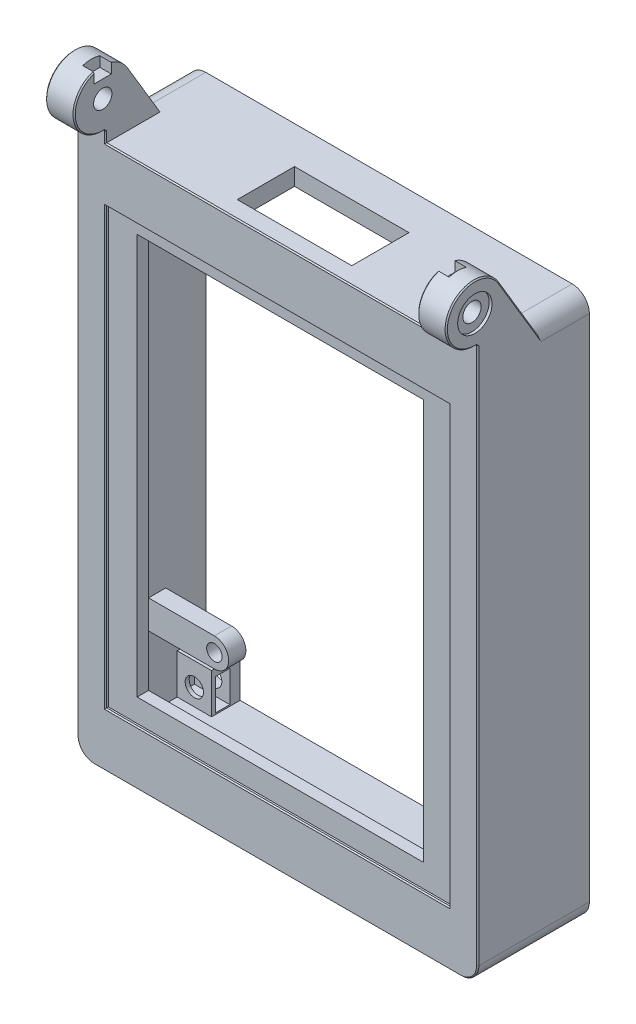
from build123d import *

# Parameters (mm, degrees)
SKETCH_1_W               = 70
SKETCH_1_H               = 95
EXTRUDE_1_DEPTH          = 20
SHELL_1_T                = -3
SKETCH_2_W               = 60
SKETCH_2_H               = 76
CUT_EXTRUDE_1_DEPTH      = 1
SKETCH_3_W               = 50
SKETCH_3_H               = 70
CUT_EXTRUDE_2_DEPTH      = 20
SKETCH_4_R               = 1.35
EXTRUDE_2_DEPTH          = 3
SKETCH_5_W               = 5
SKETCH_5_H               = 7
EXTRUDE_3_DEPTH          = 6
SKETCH_6_W               = 2.5
SKETCH_6_H               = 5.5
CUT_EXTRUDE_3_DEPTH      = 6.2
SKETCH_7_R               = 1.6
CUT_EXTRUDE_4_DEPTH      = 6.2
MIRROR_2_COPY_1_SKETCH_W = 5
MIRROR_2_COPY_1_SKETCH_H = 7
MIRROR_2_COPY_1_DEPTH    = 6
MIRROR_4_COPY_1_SKETCH_W = 2.5
MIRROR_4_COPY_1_SKETCH_H = 5.5
MIRROR_4_COPY_1_DEPTH    = 6.2
MIRROR_6_COPY_1_SKETCH_R = 1.6
MIRROR_6_COPY_1_DEPTH    = 6.2
EXTRUDE_4_DEPTH          = 70
SKETCH_9_R               = 1.6
CUT_EXTRUDE_5_DEPTH      = 70
SKETCH_10_W              = 60
SKETCH_10_H              = 12
CUT_EXTRUDE_6_DEPTH      = 30
SKETCH_11_W              = 3
SKETCH_11_H              = 7
CUT_EXTRUDE_7_DEPTH      = 2
SKETCH_12_R              = 3
CUT_EXTRUDE_8_DEPTH      = 0.5
CUT_EXTRUDE_9_DEPTH      = 0.5
SKETCH_14_W              = 20
SKETCH_14_H              = 10
CUT_EXTRUDE_10_DEPTH     = 10
FILLET_1_R               = 3
CHAMFER_1_SIZE           = 0.2


with BuildPart() as part:
    # 草图1 → 凸台-拉伸1 (new body)
    with BuildSketch(Plane.XY):
        Rectangle(SKETCH_1_W, SKETCH_1_H)
    extrude(amount=EXTRUDE_1_DEPTH)

    # 抽壳1
    shell_1_openings = [part.faces().sort_by_distance(p)[0] for p in [
        (0, 0, 0),
    ]]
    offset(amount=SHELL_1_T, openings=shell_1_openings, kind=Kind.INTERSECTION)

    # 草图2 → 切除-拉伸1 (cut)
    with BuildSketch(Plane.XY.offset(20)):
        Rectangle(SKETCH_2_W, SKETCH_2_H)
    extrude(amount=-CUT_EXTRUDE_1_DEPTH, mode=Mode.SUBTRACT)

    # 草图3 → 切除-拉伸2 (cut)
    with BuildSketch(Plane.XY.offset(19)):
        with Locations((0, 1)):
            Rectangle(SKETCH_3_W, SKETCH_3_H)
    extrude(amount=-CUT_EXTRUDE_2_DEPTH, mode=Mode.SUBTRACT)

    # 草图4 → 凸台-拉伸2 (add)
    # profile 1 of 4: a face of its own
    with BuildSketch(Plane.XY.offset(10)):
        with BuildLine():
            Line((20.5, 33), (32, 33))
            Line((32, 33), (32, 28))
            Line((32, 28), (20.5, 28))
            ThreePointArc((20.5, 28), (18, 30.5), (20.5, 33))
        make_face()
        with Locations((20.5, 30.5)):
            Circle(SKETCH_4_R, mode=Mode.SUBTRACT)
    # profile 2 of 4: a face of its own
    with BuildSketch(Plane.XY.offset(10)):
        with BuildLine():
            Line((-20.5, 33), (-32, 33))
            Line((-32, 33), (-32, 28))
            Line((-32, 28), (-20.5, 28))
            ThreePointArc((-20.5, 28), (-18, 30.5), (-20.5, 33))
        make_face()
        with Locations((-20.5, 30.5)):
            Circle(SKETCH_4_R, mode=Mode.SUBTRACT)
    # profile 3 of 4: a face of its own
    with BuildSketch(Plane.XY.offset(10)):
        with BuildLine():
            Line((-20.5, -27), (-32, -27))
            Line((-32, -27), (-32, -32))
            Line((-32, -32), (-20.5, -32))
            ThreePointArc((-20.5, -32), (-18, -29.5), (-20.5, -27))
        make_face()
        with Locations((-20.5, -29.5)):
            Circle(SKETCH_4_R, mode=Mode.SUBTRACT)
    # profile 4 of 4: a face of its own
    with BuildSketch(Plane.XY.offset(10)):
        with BuildLine():
            Line((20.5, -27), (32, -27))
            Line((32, -27), (32, -32))
            Line((32, -32), (20.5, -32))
            ThreePointArc((20.5, -32), (18, -29.5), (20.5, -27))
        make_face()
        with Locations((20.5, -29.5)):
            Circle(SKETCH_4_R, mode=Mode.SUBTRACT)
    extrude(amount=-EXTRUDE_2_DEPTH)

    # 草图5 → 凸台-拉伸3 (add)
    with BuildSketch(Plane(origin=(-32, 0, 0), x_dir=(0, 0, -1), z_dir=(1, 0, 0))):
        with Locations((-2.5, 41)):
            Rectangle(SKETCH_5_W, SKETCH_5_H)
    extrude_3 = extrude(amount=EXTRUDE_3_DEPTH)

    # 草图6 → 切除-拉伸3 (cut)
    with BuildSketch(Plane(origin=(-26, 0, 0), x_dir=(0, 0, -1), z_dir=(1, 0, 0))):
        with Locations((-3.05, 41.5)):
            Rectangle(SKETCH_6_W, SKETCH_6_H)
    cut_extrude_3 = extrude(amount=-CUT_EXTRUDE_3_DEPTH, mode=Mode.SUBTRACT)

    # 草图7 → 切除-拉伸4 (cut)
    with BuildSketch(Plane(origin=(0, 0, 0), x_dir=(-1, 0, 0), z_dir=(0, 0, -1))):
        with Locations((29, 41.5)):
            Circle(SKETCH_7_R)
    cut_extrude_4 = extrude(amount=-CUT_EXTRUDE_4_DEPTH, mode=Mode.SUBTRACT)

    # 镜向1: 凸台-拉伸3 across plane
    add(extrude_3.mirror(Plane.ZX))

    # 镜向2: 凸台-拉伸3 across plane
    add(extrude_3.mirror(Plane(origin=(0, 0, 0), x_dir=(0, 0, 1), z_dir=(1, 0, 0))))

    # 镜向2 copy 1 sketch → 镜向2 copy 1 (add)
    with BuildSketch(Plane(origin=(32, 0, 0), x_dir=(0, 0, -1), z_dir=(-1, 0, 0))):
        with Locations((-2.5, 41)):
            Rectangle(MIRROR_2_COPY_1_SKETCH_W, MIRROR_2_COPY_1_SKETCH_H)
    extrude(amount=MIRROR_2_COPY_1_DEPTH)

    # 镜向3: 切除-拉伸3 across plane
    add(cut_extrude_3.mirror(Plane.ZX), mode=Mode.SUBTRACT)

    # 镜向4: 切除-拉伸3 across plane
    add(cut_extrude_3.mirror(Plane(origin=(0, 0, 0), x_dir=(0, 0, 1), z_dir=(1, 0, 0))), mode=Mode.SUBTRACT)

    # 镜向4 copy 1 sketch → 镜向4 copy 1 (cut)
    with BuildSketch(Plane(origin=(26, 0, 0), x_dir=(0, 0, -1), z_dir=(-1, 0, 0))):
        with Locations((-3.05, 41.5)):
            Rectangle(MIRROR_4_COPY_1_SKETCH_W, MIRROR_4_COPY_1_SKETCH_H)
    extrude(amount=-MIRROR_4_COPY_1_DEPTH, mode=Mode.SUBTRACT)

    # 镜向5: 切除-拉伸4 across plane
    add(cut_extrude_4.mirror(Plane.ZX), mode=Mode.SUBTRACT)

    # 镜向6: 切除-拉伸4 across plane
    add(cut_extrude_4.mirror(Plane(origin=(0, 0, 0), x_dir=(0, 0, 1), z_dir=(1, 0, 0))), mode=Mode.SUBTRACT)

    # 镜向6 copy 1 sketch → 镜向6 copy 1 (cut)
    with BuildSketch(Plane(origin=(0, 0, 0), x_dir=(1, 0, 0), z_dir=(0, 0, -1))):
        with Locations((29, 41.5)):
            Circle(MIRROR_6_COPY_1_SKETCH_R)
    extrude(amount=-MIRROR_6_COPY_1_DEPTH, mode=Mode.SUBTRACT)

    # 草图8 → 凸台-拉伸4 (add)
    with BuildSketch(Plane(origin=(35, 0, 0), x_dir=(0, 0, -1), z_dir=(1, 0, 0))):
        with BuildLine():
            Line((-15.706419427, 57.062257962), (-10, 47.5))
            Line((-10, 47.5), (-20, 47.5))
            Line((-20, 47.5), (-20, 49.5))
            ThreePointArc((-20, 49.5), (-24.348062201, 56.968674765), (-15.706419427, 57.062257962))
        make_face()
    extrude(amount=-EXTRUDE_4_DEPTH)

    # 草图9 → 切除-拉伸5 (cut)
    with BuildSketch(Plane(origin=(35, 0, 0), x_dir=(0, 0, -1), z_dir=(1, 0, 0))):
        with Locations((-20, 54.5)):
            Circle(SKETCH_9_R)
    extrude(amount=-CUT_EXTRUDE_5_DEPTH, mode=Mode.SUBTRACT)

    # 草图10 → 切除-拉伸6 (cut)
    with BuildSketch(Plane(origin=(0, 0, 0), x_dir=(-1, 0, 0), z_dir=(0, 0, -1))):
        with Locations((0, 53.5)):
            Rectangle(SKETCH_10_W, SKETCH_10_H)
    extrude(amount=-CUT_EXTRUDE_6_DEPTH, mode=Mode.SUBTRACT)

    # 草图11 → 切除-拉伸7 (cut)
    with BuildSketch(Plane(origin=(-30, 0, 0), x_dir=(0, 0, -1), z_dir=(1, 0, 0))):
        with Locations((-20, 61)):
            Rectangle(SKETCH_11_W, SKETCH_11_H)
    cut_extrude_7 = extrude(amount=-CUT_EXTRUDE_7_DEPTH, mode=Mode.SUBTRACT)

    # 镜向7: 切除-拉伸7 across plane
    add(cut_extrude_7.mirror(Plane(origin=(0, 0, 0), x_dir=(0, 0, 1), z_dir=(1, 0, 0))), mode=Mode.SUBTRACT)

    # 草图12 → 切除-拉伸8 (cut)
    with BuildSketch(Plane(origin=(35, 0, 0), x_dir=(0, 0, -1), z_dir=(1, 0, 0))):
        with Locations((-20, 54.5)):
            Circle(SKETCH_12_R)
    cut_extrude_8 = extrude(amount=-CUT_EXTRUDE_8_DEPTH, mode=Mode.SUBTRACT)

    # 镜向8: 切除-拉伸8 across plane
    add(cut_extrude_8.mirror(Plane(origin=(0, 0, 0), x_dir=(0, 0, 1), z_dir=(1, 0, 0))), mode=Mode.SUBTRACT)

    # 草图13 → 切除-拉伸9 (cut)
    with BuildSketch(Plane.XY.offset(20)):
        Polygon((35, 49.5), (30, 49.5), (30, 47.5), (-30, 47.5), (-30, 49.5), (-35, 49.5), (-35, -47.5), (35, -47.5), align=None)
    extrude(amount=-CUT_EXTRUDE_9_DEPTH, mode=Mode.SUBTRACT)

    # 草图14 → 切除-拉伸10 (cut)
    with BuildSketch(Plane(origin=(0, 47.5, 0), x_dir=(1, 0, 0), z_dir=(0, 1, 0))):
        with Locations((0, -11.5)):
            Rectangle(SKETCH_14_W, SKETCH_14_H)
    extrude(amount=-CUT_EXTRUDE_10_DEPTH, mode=Mode.SUBTRACT)

    # 圆角1
    fillet_1_edges = [part.edges().sort_by_distance(p)[0] for p in [
        (-35, 47.5, 5),
        (35, 47.5, 5),
        (35, -47.5, 9.75),
        (-35, -47.5, 9.75),
    ]]
    fillet(fillet_1_edges, radius=FILLET_1_R)

    # 倒角1
    chamfer_1_edges = [part.edges().sort_by_distance(p)[0] for p in [
        (0, 38, 19.5),
        (-30, 0, 19.5),
        (0, -38, 19.5),
        (30, 0, 19.5),
        (-35, 50.781128981, 11.95806244),
        (35, 50.781128981, 11.95806244),
        (-30, 53.741211504, 24.942088629),
        (-35, 56.968674765, 24.348062201),
        (30, 53.741211504, 24.942088629),
        (35, 56.968674765, 24.348062201),
        (-30, 49.5, 19.75),
        (-35, 49.5, 19.75),
        (30, 49.5, 19.75),
        (35, 49.5, 19.75),
        (-32.5, 49.5, 19.5),
        (-30, 48.5, 19.5),
        (0, 47.5, 19.5),
        (30, 48.5, 19.5),
        (32.5, 49.5, 19.5),
        (35, 2.5, 19.5),
        (34.121320344, -46.621320344, 19.5),
        (0, -47.5, 19.5),
        (-34.121320344, -46.621320344, 19.5),
        (-35, 2.5, 19.5),
    ]]
    chamfer(chamfer_1_edges, length=CHAMFER_1_SIZE)


solid = part.part
